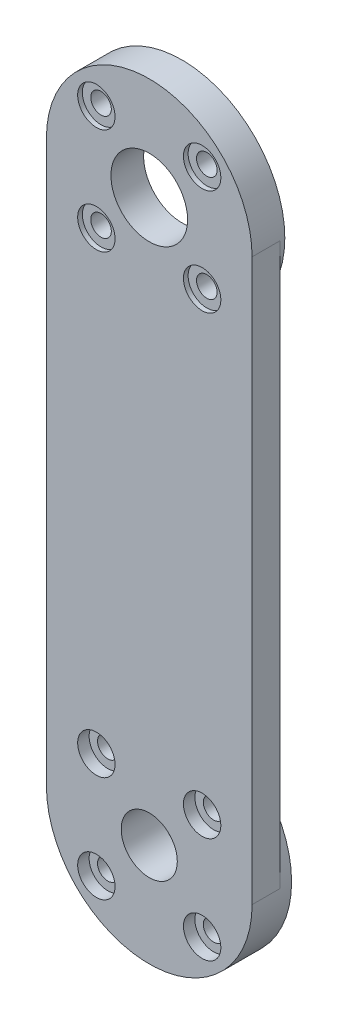
from build123d import *

# Parameters (mm, degrees)
BOSS_EXTRUDE1_DEPTH = 3
BOSS_EXTRUDE2_START = -0.5
SKETCH1_3_R         = 11
BOSS_EXTRUDE2_DEPTH = 0.5
SKETCH2_R           = 4.1
SKETCH2_R_2         = 1.1
CUT_EXTRUDE1_DEPTH  = 3.5
SKETCH2_3_R         = 2
CUT_EXTRUDE2_DEPTH  = 0.5
CIRPATTERN2_COUNT   = 4
BOSS_EXTRUDE3_START = -1.225
SKETCH1_5_R         = 11
BOSS_EXTRUDE3_DEPTH = 1.225
SKETCH3_R           = 3
SKETCH3_R_2         = 1.1
CUT_EXTRUDE3_DEPTH  = 4.225
SKETCH3_3_R         = 2
CUT_EXTRUDE4_DEPTH  = 1.225
CIRPATTERN3_COUNT   = 4


with BuildPart() as part:
    # Sketch1 → Boss-Extrude1 (new body)
    with BuildSketch(Plane.XY):
        with BuildLine():
            Line((-11, 30), (-11, -30))
            ThreePointArc((-11, -30), (0, -41), (11, -30))
            Line((11, -30), (11, 30))
            ThreePointArc((11, 30), (0, 41), (-11, 30))
        make_face()
    extrude(amount=BOSS_EXTRUDE1_DEPTH)

    # Sketch1<3> → Boss-Extrude2 (add)
    with BuildSketch(Plane.XY.offset(BOSS_EXTRUDE2_START)):
        with Locations((0, 30)):
            Circle(SKETCH1_3_R)
    extrude(amount=BOSS_EXTRUDE2_DEPTH)

    # Sketch2 → Cut-Extrude1 (cut)
    with BuildSketch(Plane.XY.offset(3)):
        with Locations((0, 30)):
            Circle(SKETCH2_R)
        with Locations((5.656854249, 35.656854249)):
            Circle(SKETCH2_R_2)
    cut_extrude1 = extrude(amount=-CUT_EXTRUDE1_DEPTH, mode=Mode.SUBTRACT)

    # Sketch2<3> → Cut-Extrude2 (cut)
    with BuildSketch(Plane.XY.offset(3)):
        with Locations((5.656854249, 35.656854249)):
            Circle(SKETCH2_3_R)
    cut_extrude2 = extrude(amount=-CUT_EXTRUDE2_DEPTH, mode=Mode.SUBTRACT)

    # CirPattern2: Cut-Extrude1, Cut-Extrude2 ×4 about axis
    cirpattern2_axis = Axis((0, 30, 0), (0, 0, 1))
    add([cut_extrude1.rotate(cirpattern2_axis, i * 360 / CIRPATTERN2_COUNT) for i in range(1, CIRPATTERN2_COUNT)], mode=Mode.SUBTRACT)
    add([cut_extrude2.rotate(cirpattern2_axis, i * 360 / CIRPATTERN2_COUNT) for i in range(1, CIRPATTERN2_COUNT)], mode=Mode.SUBTRACT)

    # Sketch1<5> → Boss-Extrude3 (add)
    with BuildSketch(Plane.XY.offset(BOSS_EXTRUDE3_START)):
        with Locations((0, -30)):
            Circle(SKETCH1_5_R)
    extrude(amount=BOSS_EXTRUDE3_DEPTH)

    # Sketch3 → Cut-Extrude3 (cut)
    with BuildSketch(Plane.XY.offset(3)):
        with Locations((0, -30)):
            Circle(SKETCH3_R)
        with Locations((5.656854249, -24.343145751)):
            Circle(SKETCH3_R_2)
    cut_extrude3 = extrude(amount=-CUT_EXTRUDE3_DEPTH, mode=Mode.SUBTRACT)

    # Sketch3<3> → Cut-Extrude4 (cut)
    with BuildSketch(Plane.XY.offset(3)):
        with Locations((5.656854249, -24.343145751)):
            Circle(SKETCH3_3_R)
    cut_extrude4 = extrude(amount=-CUT_EXTRUDE4_DEPTH, mode=Mode.SUBTRACT)

    # CirPattern3: Cut-Extrude3, Cut-Extrude4 ×4 about axis
    cirpattern3_axis = Axis((0, -30, 0), (0, 0, 1))
    add([cut_extrude3.rotate(cirpattern3_axis, i * 360 / CIRPATTERN3_COUNT) for i in range(1, CIRPATTERN3_COUNT)], mode=Mode.SUBTRACT)
    add([cut_extrude4.rotate(cirpattern3_axis, i * 360 / CIRPATTERN3_COUNT) for i in range(1, CIRPATTERN3_COUNT)], mode=Mode.SUBTRACT)


solid = part.part
